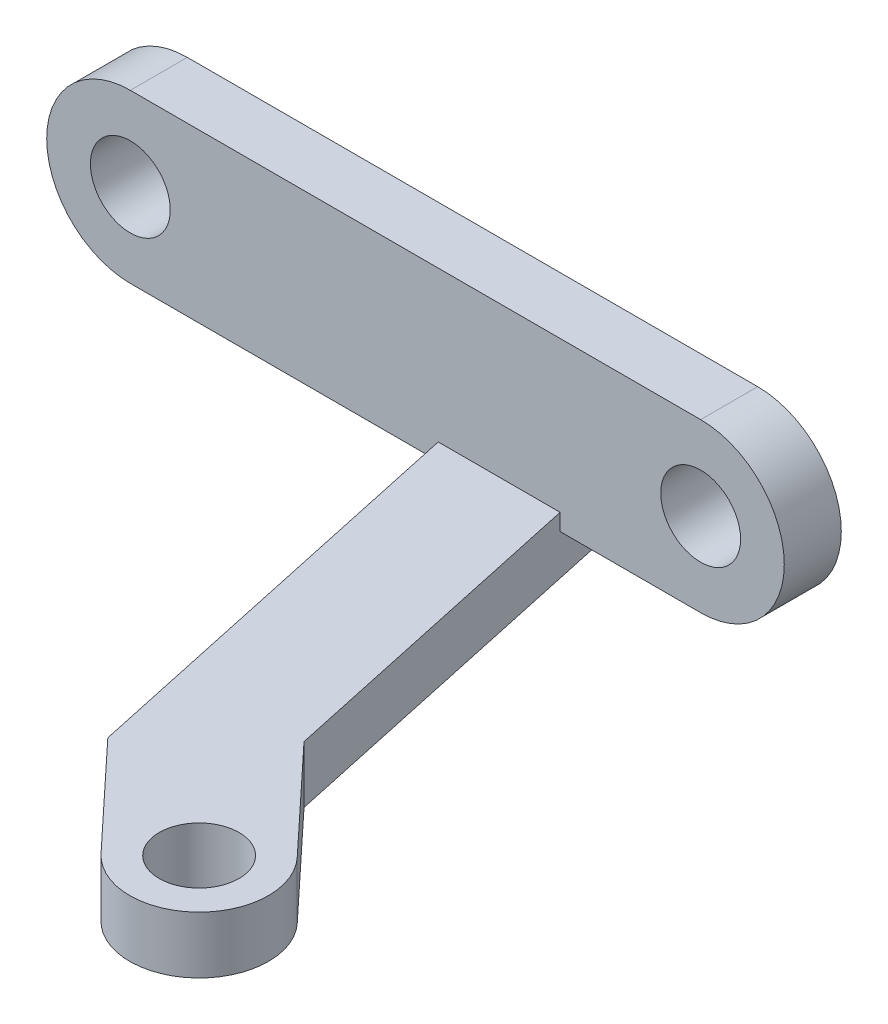
from build123d import *

# Parameters (mm, degrees)
SKETCH1_R           = 1.75
BOSS_EXTRUDE1_DEPTH = 2.5
SKETCH2_R           = 1.75
BOSS_EXTRUDE2_DEPTH = 2.5


with BuildPart() as part:
    # Sketch1 → Boss-Extrude1 (new body)
    with BuildSketch(Plane.XY):
        with BuildLine():
            Line((-51.451246925, 1.046447779), (-76.451246925, 1.046447779))
            ThreePointArc((-76.451246925, 1.046447779), (-80.116799147, 4.712), (-76.451246925, 8.377552221))
            Line((-76.451246925, 8.377552221), (-51.451246925, 8.377552221))
            ThreePointArc((-51.451246925, 8.377552221), (-47.785694704, 4.712), (-51.451246925, 1.046447779))
        make_face()
        with Locations((-76.451246925, 4.712)):
            Circle(SKETCH1_R, mode=Mode.SUBTRACT)
        with Locations((-51.451246925, 4.712)):
            Circle(SKETCH1_R, mode=Mode.SUBTRACT)
    extrude(amount=BOSS_EXTRUDE1_DEPTH)

    # Sketch2 → Boss-Extrude2 (add)
    with BuildSketch(Plane.XZ.offset(-1.777778923)):
        with BuildLine():
            Line((-58.149633546, 0), (-54.518808092, 16.818393056))
            Line((-54.518808092, 16.818393056), (-50.271714816, 21.362782861))
            ThreePointArc((-50.271714816, 21.362782861), (-50.417137666, 25.663144264), (-54.717499069, 25.517721415))
            Line((-54.717499069, 25.517721415), (-58.964592345, 20.97333161))
            Line((-58.964592345, 20.97333161), (-63.492403415, 0))
            Line((-63.492403415, 0), (-58.149633546, 0))
        make_face()
        with Locations((-52.494606943, 23.440252138)):
            Circle(SKETCH2_R, mode=Mode.SUBTRACT)
    extrude(amount=BOSS_EXTRUDE2_DEPTH)


solid = part.part
